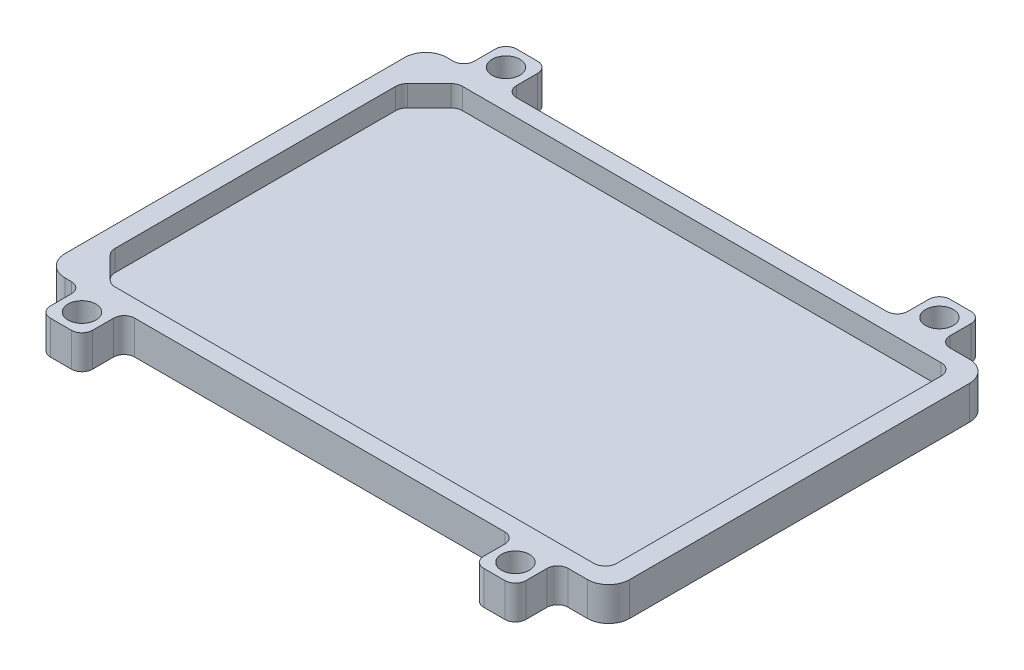
from build123d import *

# Parameters (mm, degrees)
SKETCH1_W            = 157.0786
SKETCH1_H            = 90.551
BOSS_EXTRUDE1_DEPTH  = 8
CUT_EXTRUDE21_DEPTH  = 5
FILLET8_R            = 2.75
SKETCH29_W           = 11.58993
SKETCH29_H           = 90.551
CUT_EXTRUDE25_DEPTH  = 182.486005463
FILLET9_R            = 5
SKETCH36_W           = 10
SKETCH36_H           = 10
SKETCH36_R           = 3.3
BOSS_EXTRUDE10_DEPTH = 8
FILLET10_R           = 2.5


with BuildPart() as part:
    # Sketch1 → Boss-Extrude1 (new body)
    with BuildSketch(Plane(origin=(0, 0, 0), x_dir=(1, 0, 0), z_dir=(0, 1, 0))):
        with Locations((78.5393, -45.2755)):
            Rectangle(SKETCH1_W, SKETCH1_H)
    extrude(amount=BOSS_EXTRUDE1_DEPTH)

    # Sketch23 → Cut-Extrude21 (cut)
    with BuildSketch(Plane(origin=(0, 8, 0), x_dir=(1, 0, 0), z_dir=(0, 1, 0))):
        Polygon((140.6288, -86.4755), (23.2359173, -86.4755), (16.4498, -79.6893827), (16.4498, -10.8616173), (23.2359173, -4.0755), (140.6288, -4.0755), align=None)
    extrude(amount=-CUT_EXTRUDE21_DEPTH, mode=Mode.SUBTRACT)

    # Fillet8
    fillet8_edges = [part.edges().sort_by_distance(p)[0] for p in [
        (140.6288, 5.5, 4.0755),
        (140.6288, 5.5, 86.4755),
        (23.2359173, 5.5, 86.4755),
        (16.4498, 5.5, 79.6893827),
        (16.4498, 5.5, 10.8616173),
        (23.2359173, 5.5, 4.0755),
    ]]
    fillet(fillet8_edges, radius=FILLET8_R)

    # Sketch29 → Cut-Extrude25 (cut, through all)
    with BuildSketch(Plane(origin=(0, 8, 0), x_dir=(1, 0, 0), z_dir=(0, 1, 0))):
        with Locations((151.283635, -45.2755)):
            Rectangle(SKETCH29_W, SKETCH29_H)
        with Locations((5.794965, -45.2755)):
            Rectangle(SKETCH29_W, SKETCH29_H)
    extrude(amount=-CUT_EXTRUDE25_DEPTH, mode=Mode.SUBTRACT)

    # Fillet9
    fillet9_edges = [part.edges().sort_by_distance(p)[0] for p in [
        (145.48867, 4, 90.551),
        (145.48867, 4, 0),
        (11.58993, 4, 0),
        (11.58993, 4, 90.551),
    ]]
    fillet(fillet9_edges, radius=FILLET9_R)

    # Sketch36 → Boss-Extrude10 (add)
    # profile 1 of 4: a face of its own
    with BuildSketch(Plane.XZ):
        with Locations((25.6082, 95.551)):
            Rectangle(SKETCH36_W, SKETCH36_H)
        with Locations(Location((25.6082, 95.551, 0), (0, 0, 270))):
            Circle(SKETCH36_R, mode=Mode.SUBTRACT)
    # profile 2 of 4: a face of its own
    with BuildSketch(Plane.XZ):
        with Locations((128.3942697, 95.551)):
            Rectangle(SKETCH36_W, SKETCH36_H)
        with Locations(Location((128.3942697, 95.551, 0), (0, 0, 270))):
            Circle(SKETCH36_R, mode=Mode.SUBTRACT)
    # profile 3 of 4: a face of its own
    with BuildSketch(Plane.XZ):
        with Locations((25.6082, -5)):
            Rectangle(SKETCH36_W, SKETCH36_H)
        with Locations(Location((25.6082, -5, 0), (0, 0, 270))):
            Circle(SKETCH36_R, mode=Mode.SUBTRACT)
    # profile 4 of 4: a face of its own
    with BuildSketch(Plane.XZ):
        with Locations((128.3942697, -5)):
            Rectangle(SKETCH36_W, SKETCH36_H)
        with Locations(Location((128.3942697, -5, 0), (0, 0, 270))):
            Circle(SKETCH36_R, mode=Mode.SUBTRACT)
    extrude(amount=-BOSS_EXTRUDE10_DEPTH)

    # Fillet10
    fillet10_edges = [part.edges().sort_by_distance(p)[0] for p in [
        (20.6082, 4, 90.551),
        (20.6082, 4, 100.551),
        (30.6082, 4, 100.551),
        (30.6082, 4, 90.551),
        (123.3942697, 4, 90.551),
        (123.3942697, 4, 100.551),
        (133.3942697, 4, 100.551),
        (133.3942697, 4, 90.551),
        (30.6082, 4, 0),
        (30.6082, 4, -10),
        (20.6082, 4, -10),
        (20.6082, 4, 0),
        (123.3942697, 4, -10),
        (123.3942697, 4, 0),
        (133.3942697, 4, 0),
        (133.3942697, 4, -10),
    ]]
    fillet(fillet10_edges, radius=FILLET10_R)


solid = part.part
